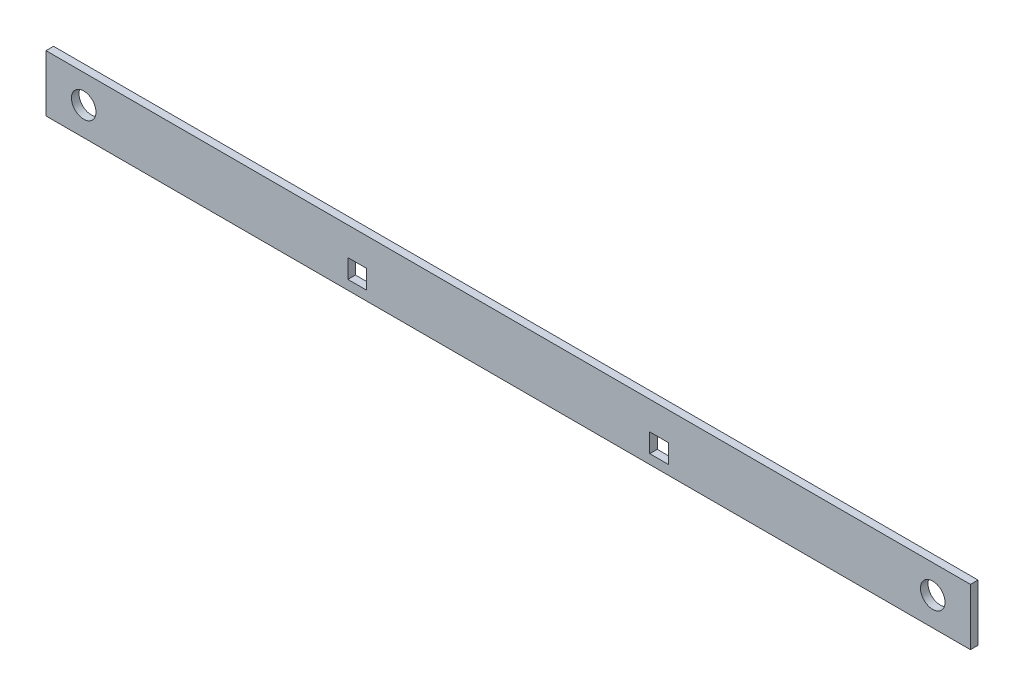
from build123d import *

# Parameters (mm, degrees)
SKETCH1_W           = 245
SKETCH1_H           = 15
SKETCH1_R           = 3.25
BOSS_EXTRUDE1_DEPTH = 2
SKETCH2_W           = 5
SKETCH2_H           = 5
CUT_EXTRUDE1_DEPTH  = 10


with BuildPart() as part:
    # Sketch1 → Boss-Extrude1 (new body)
    with BuildSketch(Plane.XY):
        Rectangle(SKETCH1_W, SKETCH1_H)
        with Locations((-112.5, 0)):
            Circle(SKETCH1_R, mode=Mode.SUBTRACT)
        with Locations((112.5, 0)):
            Circle(SKETCH1_R, mode=Mode.SUBTRACT)
    extrude(amount=BOSS_EXTRUDE1_DEPTH)

    # Sketch2 → Cut-Extrude1 (cut)
    with BuildSketch(Plane.XY.offset(2)):
        with Locations((-40, -2.5)):
            Rectangle(SKETCH2_W, SKETCH2_H)
        with Locations((40, -2.5)):
            Rectangle(SKETCH2_W, SKETCH2_H)
    extrude(amount=-CUT_EXTRUDE1_DEPTH, mode=Mode.SUBTRACT)


solid = part.part
